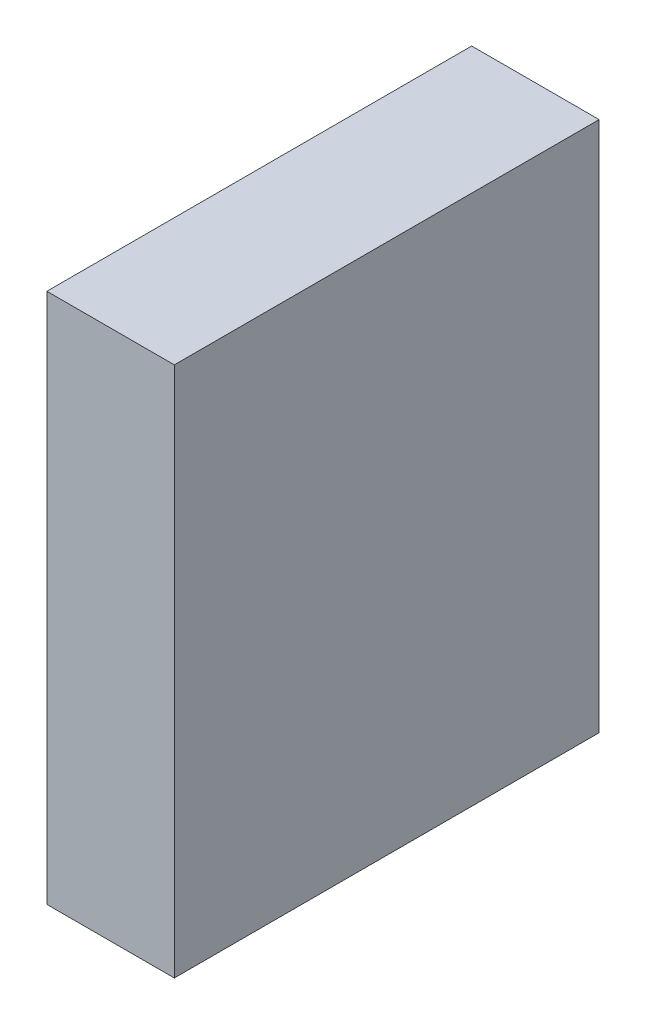
from build123d import *

# Parameters (mm, degrees)
SKETCH1_W           = 100
SKETCH1_H           = 125
BOSS_EXTRUDE1_DEPTH = 15


with BuildPart() as part:
    # Sketch1 → Boss-Extrude1 (new, symmetric)
    with BuildSketch(Plane(origin=(0, 0, 0), x_dir=(0, 0, -1), z_dir=(1, 0, 0))):
        Rectangle(SKETCH1_W, SKETCH1_H)
    extrude(amount=BOSS_EXTRUDE1_DEPTH, both=True)


solid = part.part
